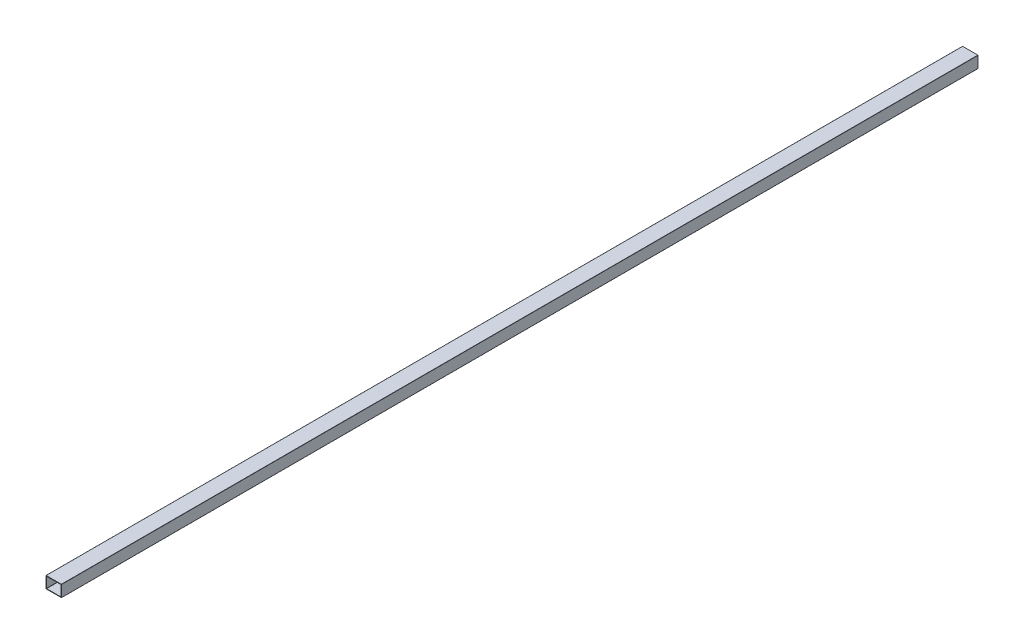
from build123d import *

# Parameters (mm, degrees)
CROQUIS1_W              = 101.6
CROQUIS1_H              = 76.2
CROQUIS1_W_2            = 95.52
CROQUIS1_H_2            = 70.12
SALIENTE_EXTRUIR1_DEPTH = 6000
REDONDEO1_R             = 1


with BuildPart() as part:
    # Croquis1 → Saliente-Extruir1 (new body)
    with BuildSketch(Plane.XY):
        Rectangle(CROQUIS1_W, CROQUIS1_H)
        Rectangle(CROQUIS1_W_2, CROQUIS1_H_2, mode=Mode.SUBTRACT)
    extrude(amount=-SALIENTE_EXTRUIR1_DEPTH)

    # Redondeo1
    redondeo1_edges = [part.edges().sort_by_distance(p)[0] for p in [
        (47.76, -35.06, -3000),
        (-47.76, -35.06, -3000),
        (-47.76, 35.06, -3000),
        (47.76, 35.06, -3000),
        (50.8, -38.1, -3000),
        (-50.8, -38.1, -3000),
        (-50.8, 38.1, -3000),
        (50.8, 38.1, -3000),
    ]]
    fillet(redondeo1_edges, radius=REDONDEO1_R)


solid = part.part
